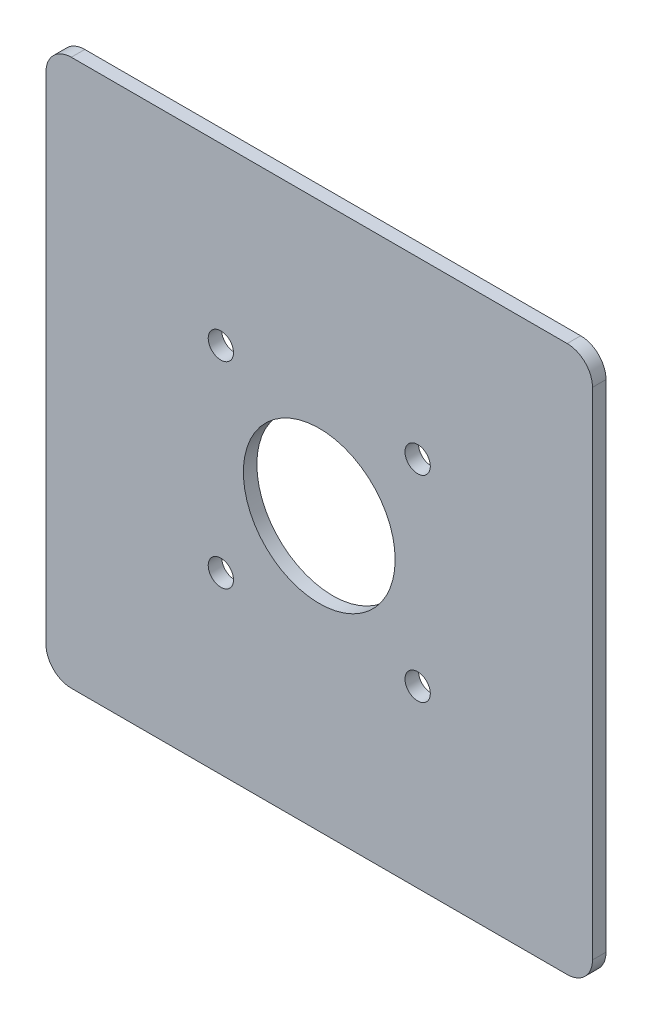
from build123d import *

# Parameters (mm, degrees)
SKETCH1_W           = 324
SKETCH1_H           = 324
BOSS_EXTRUDE1_DEPTH = 8
SKETCH2_R           = 7.5
CUT_EXTRUDE1_DEPTH  = 8
SKETCH3_R           = 45
CUT_EXTRUDE2_DEPTH  = 10
CIRPATTERN1_COUNT   = 4
FILLET1_R           = 15


with BuildPart() as part:
    # Sketch1 → Boss-Extrude1 (new body)
    with BuildSketch(Plane.XY):
        Rectangle(SKETCH1_W, SKETCH1_H)
    extrude(amount=BOSS_EXTRUDE1_DEPTH)

    # Sketch2 → Cut-Extrude1 (cut)
    with BuildSketch(Plane.XY.offset(8)):
        with Locations((58.336309448, 58.336309448)):
            Circle(SKETCH2_R)
    cut_extrude1 = extrude(amount=-CUT_EXTRUDE1_DEPTH, mode=Mode.SUBTRACT)

    # Sketch3 → Cut-Extrude2 (cut)
    with BuildSketch(Plane.XY.offset(8)):
        Circle(SKETCH3_R)
    extrude(amount=-CUT_EXTRUDE2_DEPTH, mode=Mode.SUBTRACT)

    # CirPattern1: Cut-Extrude1 ×4 about axis
    cirpattern1_axis = Axis((0, 0, 0), (0, 0, 1))
    for i in range(1, CIRPATTERN1_COUNT):
        add(cut_extrude1.rotate(cirpattern1_axis, i * 360 / CIRPATTERN1_COUNT), mode=Mode.SUBTRACT)

    # Fillet1
    fillet1_edges = [part.edges().sort_by_distance(p)[0] for p in [
        (162, -162, 4),
        (-162, -162, 4),
        (-162, 162, 4),
        (162, 162, 4),
    ]]
    fillet(fillet1_edges, radius=FILLET1_R)


solid = part.part
